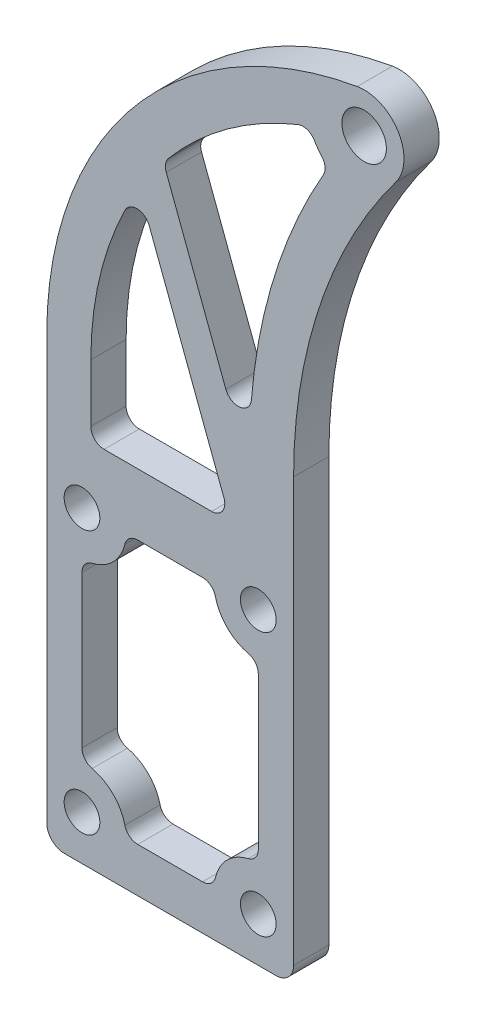
from build123d import *

# Parameters (mm, degrees)
SKETCH_1_R          = 1.525
EXTRUDE_1_DEPTH     = 2
FILLET_1_R          = 2
SKETCH_3_R          = 2.525
CUT_EXTRUDE_1_DEPTH = 11
SKETCH_4_R          = 2.025
CUT_EXTRUDE_2_DEPTH = 20
CUT_EXTRUDE_3_DEPTH = 20
FILLET_2_R          = 1.5
CUT_EXTRUDE_4_DEPTH = 10
EXTRUDE_2_DEPTH     = 4
FILLET_3_R          = 1.5


with BuildPart() as part:
    # 草图1 → 凸台-拉伸1 (new, symmetric)
    with BuildSketch(Plane.XY):
        with BuildLine():
            Line((-14, -25), (14, -25))
            Line((14, -25), (14, 25))
            ThreePointArc((14, 25), (16.980954382, 43.334686237), (25.616740047, 59.780658824))
            ThreePointArc((25.616740047, 59.780658824), (25.857254614, 64.865842734), (21.215464165, 66.956470411))
            ThreePointArc((21.215464165, 66.956470411), (-4.029350016, 52.38829278), (-14, 25))
            Line((-14, 25), (-14, -25))
        make_face()
        with Locations((22, 62.5)):
            Circle(SKETCH_1_R, mode=Mode.SUBTRACT)
    extrude(amount=EXTRUDE_1_DEPTH, both=True)

    # 圆角1
    fillet_1_edges = [part.edges().sort_by_distance(p)[0] for p in [
        (14, -25, 0),
        (-14, -25, 0),
    ]]
    fillet(fillet_1_edges, radius=FILLET_1_R)

    # 草图3 → 切除-拉伸1 (cut, symmetric)
    with BuildSketch(Plane.XY.offset(2)):
        with Locations(Location((22, 62.5, 0), (0, 0, 180))):
            Circle(SKETCH_3_R)
    extrude(amount=CUT_EXTRUDE_1_DEPTH, both=True, mode=Mode.SUBTRACT)

    # 草图4 → 切除-拉伸2 (cut)
    with BuildSketch(Plane.XY.offset(2)):
        with Locations((-10.004554112, 9.95)):
            Circle(SKETCH_4_R)
        with Locations((9.995445888, 9.95)):
            Circle(SKETCH_4_R)
        with Locations((9.995445888, -19.95)):
            Circle(SKETCH_4_R)
        with Locations((-10.004554112, -19.95)):
            Circle(SKETCH_4_R)
    extrude(amount=-CUT_EXTRUDE_2_DEPTH, mode=Mode.SUBTRACT)

    # 草图5 → 切除-拉伸3 (cut)
    with BuildSketch(Plane.XY.offset(2)):
        with BuildLine():
            ThreePointArc((-10.004554112, -14.95), (-6.469020206, -16.414466094), (-5.004554112, -19.95))
            Line((-5.004554112, -19.95), (4.995445888, -19.95))
            ThreePointArc((4.995445888, -19.95), (6.459911982, -16.414466094), (9.995445888, -14.95))
            Line((9.995445888, -14.95), (9.995445888, 4.95))
            ThreePointArc((9.995445888, 4.95), (6.459911982, 6.414466094), (4.995445888, 9.95))
            Line((4.995445888, 9.95), (-5.004554112, 9.95))
            ThreePointArc((-5.004554112, 9.95), (-6.469020206, 6.414466094), (-10.004554112, 4.95))
            Line((-10.004554112, 4.95), (-10.004554112, -14.95))
        make_face()
    extrude(amount=-CUT_EXTRUDE_3_DEPTH, mode=Mode.SUBTRACT)

    # 圆角2
    fillet_2_edges = [part.edges().sort_by_distance(p)[0] for p in [
        (9.995445888, -14.95, 0),
        (4.995445888, -19.95, 0),
        (-5.004554112, -19.95, 0),
        (-10.004554112, -14.95, 0),
        (-10.004554112, 4.95, 0),
        (-5.004554112, 9.95, 0),
        (4.995445888, 9.95, 0),
        (9.995445888, 4.95, 0),
    ]]
    fillet(fillet_2_edges, radius=FILLET_2_R)

    # 草图6 → 切除-拉伸4 (cut)
    with BuildSketch(Plane.XY.offset(2)):
        with BuildLine():
            Line((-9, 25), (-9, 16.95))
            Line((-9, 16.95), (9, 16.95))
            Line((9, 16.95), (9, 25))
            ThreePointArc((9, 25), (11.284284207, 41.793802743), (17.971158754, 57.367353196))
            ThreePointArc((17.971158754, 57.367353196), (16.686132643, 58.713386908), (15.833336193, 60.367423509))
            ThreePointArc((15.833336193, 60.367423509), (-2.171664491, 46.607575246), (-9, 25))
        make_face()
    extrude(amount=-CUT_EXTRUDE_4_DEPTH, mode=Mode.SUBTRACT)

    # 草图7 → 凸台-拉伸2 (add)
    with BuildSketch(Plane.XY.offset(2)):
        Polygon((-4.043281882, 45.902558691), (7.128382609, 16.244983445), (10.871617391, 17.655016555), (-0.748810192, 48.503929507), align=None)
    extrude(amount=-EXTRUDE_2_DEPTH)

    # 圆角3
    fillet_3_edges = [part.edges().sort_by_distance(p)[0] for p in [
        (-0.748810192, 48.503929507, 0),
        (15.833336193, 60.367423509, 0),
        (9, 22.623625632, 0),
        (17.971158754, 57.367353196, 0),
        (-3.527808844, 44.534125149, 0),
        (-9, 16.95, 0),
        (6.862811053, 16.95, 0),
    ]]
    fillet(fillet_3_edges, radius=FILLET_3_R)


solid = part.part
